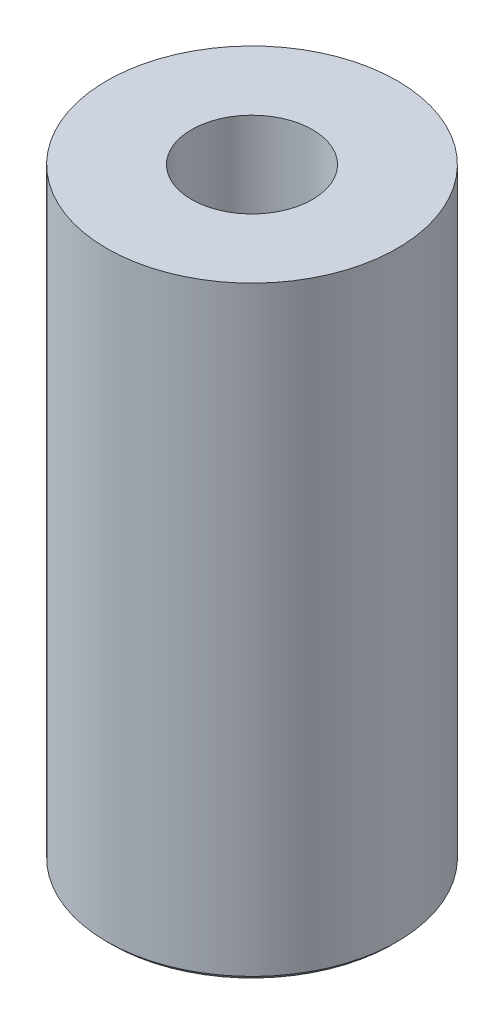
from build123d import *

# Parameters (mm, degrees)
SKETCH_1_R      = 6
EXTRUDE_1_DEPTH = 25
M6X1_0_1_D      = 5
M6X1_0_1_DEPTH  = 6
M6X1_0_1_TIP    = 1.502151548
CHAMFER_1_SIZE  = 0.2


with BuildPart() as part:
    # 草图1 → 凸台-拉伸1 (new body)
    with BuildSketch(Plane(origin=(0, 0, 0), x_dir=(1, 0, 0), z_dir=(0, 1, 0))):
        with Locations(Location((0, 0, 0), (0, 0, 270))):
            Circle(SKETCH_1_R)
    extrude(amount=EXTRUDE_1_DEPTH)

    # M6x1.0 螺纹孔1
    with Locations(Plane(origin=(0, 25, 0), x_dir=(1, 0, 0), z_dir=(0, 1, 0))):
        with Locations((0, 0)):
            Hole(M6X1_0_1_D / 2, depth=M6X1_0_1_DEPTH)
            with Locations((0, 0, -(M6X1_0_1_DEPTH + M6X1_0_1_TIP / 2))):  # 118° drill point
                Cone(0, M6X1_0_1_D / 2, M6X1_0_1_TIP, mode=Mode.SUBTRACT)

    # 倒角1
    chamfer_1_edges = [part.edges().sort_by_distance(p)[0] for p in [
        (0, 0, -6),
    ]]
    chamfer(chamfer_1_edges, length=CHAMFER_1_SIZE)


solid = part.part
